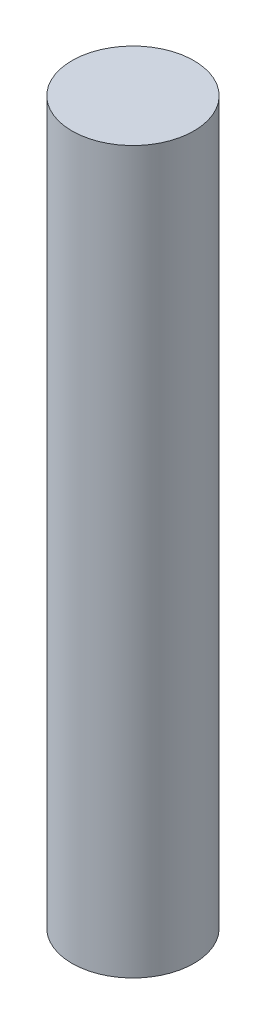
from build123d import *

# Parameters (mm, degrees)
SKETCH1_R           = 6.85
BOSS_EXTRUDE1_DEPTH = 81


with BuildPart() as part:
    # Sketch1 → Boss-Extrude1 (new body)
    with BuildSketch(Plane(origin=(0, 0, 0), x_dir=(1, 0, 0), z_dir=(0, 1, 0))):
        with Locations(Location((0, 0, 0), (0, 0, 270))):
            Circle(SKETCH1_R)
    extrude(amount=BOSS_EXTRUDE1_DEPTH)


solid = part.part
